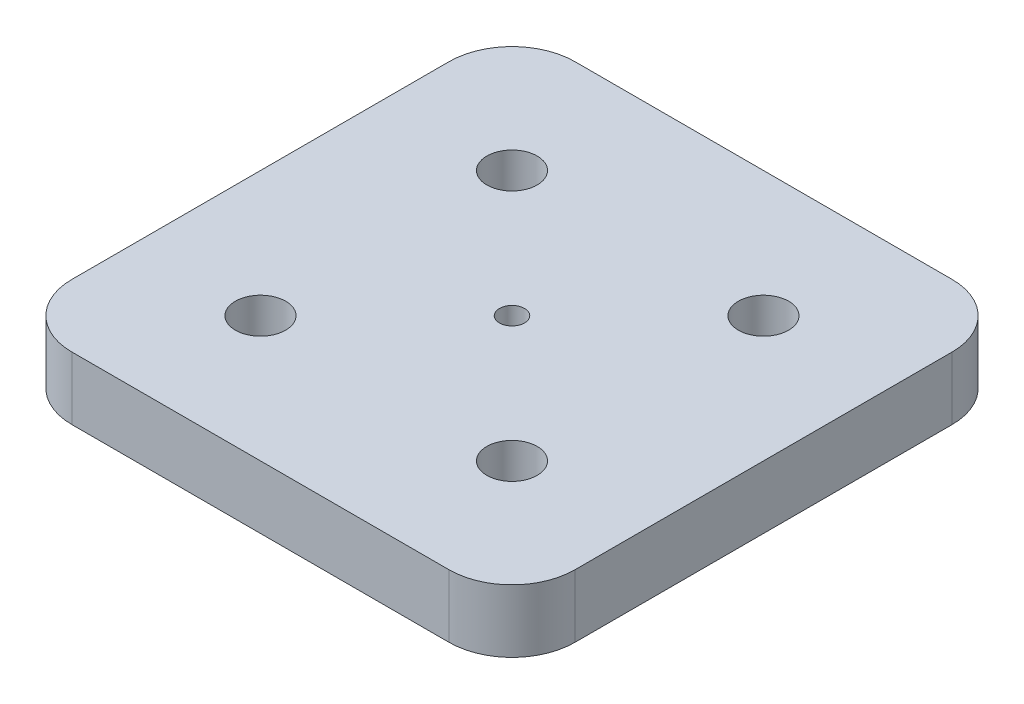
from build123d import *

# Parameters (mm, degrees)
SKETCH1_W           = 40
SKETCH1_H           = 40
SKETCH1_R           = 2
SKETCH1_R_2         = 1
BOSS_EXTRUDE1_DEPTH = 5
FILLET1_R           = 5


with BuildPart() as part:
    # Sketch1 → Boss-Extrude1 (new body)
    with BuildSketch(Plane(origin=(0, 0, 0), x_dir=(1, 0, 0), z_dir=(0, 1, 0))):
        with Locations((20, 20)):
            Rectangle(SKETCH1_W, SKETCH1_H)
        with Locations(Location((10, 30, 0), (0, 0, 270))):
            Circle(SKETCH1_R, mode=Mode.SUBTRACT)
        with Locations(Location((30, 30, 0), (0, 0, 90))):
            Circle(SKETCH1_R, mode=Mode.SUBTRACT)
        with Locations(Location((30, 10, 0), (0, 0, 270))):
            Circle(SKETCH1_R, mode=Mode.SUBTRACT)
        with Locations(Location((10, 10, 0), (0, 0, 90))):
            Circle(SKETCH1_R, mode=Mode.SUBTRACT)
        with Locations(Location((20, 20, 0), (0, 0, 270))):
            Circle(SKETCH1_R_2, mode=Mode.SUBTRACT)
    extrude(amount=BOSS_EXTRUDE1_DEPTH)

    # Fillet1
    fillet1_edges = [part.edges().sort_by_distance(p)[0] for p in [
        (0, 2.5, -40),
        (40, 2.5, -40),
        (40, 2.5, 0),
        (0, 2.5, 0),
    ]]
    fillet(fillet1_edges, radius=FILLET1_R)


solid = part.part
